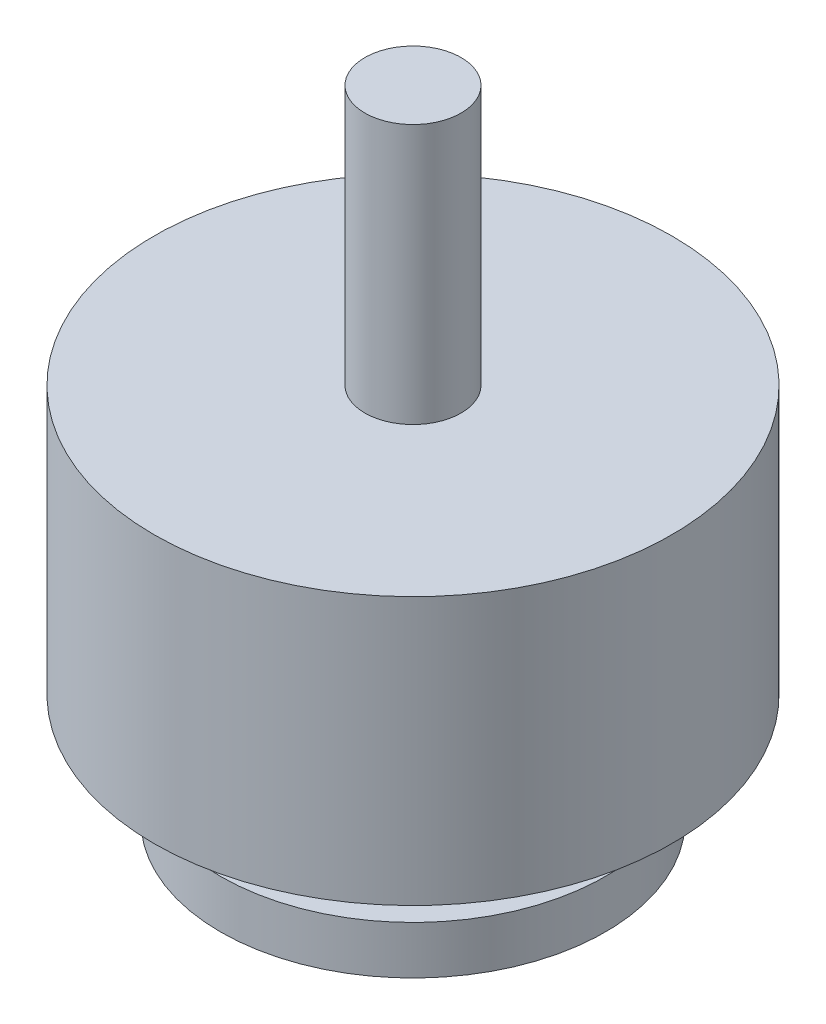
from build123d import *

# Parameters (mm, degrees)
SKETCH1_R           = 13.45
BOSS_EXTRUDE1_DEPTH = 13.9
SKETCH2_R           = 10
SKETCH2_R_2         = 1.5
BOSS_EXTRUDE3_DEPTH = 2.5
BOSS_EXTRUDE4_REACH = 27.578
SKETCH3_R           = 5
SKETCH4_R           = 2.5
BOSS_EXTRUDE5_DEPTH = 13.5


with BuildPart() as part:
    # Sketch1 → Boss-Extrude1 (new body)
    with BuildSketch(Plane(origin=(0, 0, 0), x_dir=(1, 0, 0), z_dir=(0, 1, 0))):
        with Locations(Location((0, 0, 0), (0, 0, 270))):
            Circle(SKETCH1_R)
    extrude(amount=BOSS_EXTRUDE1_DEPTH)

    # Sketch3 → Boss-Extrude4 (add, up to next)
    with BuildSketch(Plane(origin=(0, -3.2, 0), x_dir=(1, 0, 0), z_dir=(0, 1, 0)), mode=Mode.PRIVATE) as boss_extrude4_sk1:
        with Locations(Location((0, 0, 0), (0, 0, 270))):
            Circle(SKETCH3_R)
    boss_extrude4_tool1 = extrude(boss_extrude4_sk1.sketch, amount=BOSS_EXTRUDE4_REACH, mode=Mode.PRIVATE) - part.part


with BuildPart() as body_2:
    # Sketch2 → Boss-Extrude3 (new body)
    with BuildSketch(Plane.XZ.offset(5.7)):
        with Locations(Location((0, 0, 0), (0, 0, 270))):
            Circle(SKETCH2_R)
        with Locations(Location((0, 8, 0), (0, 0, 270))):
            Circle(SKETCH2_R_2, mode=Mode.SUBTRACT)
        with Locations(Location((8, 0, 0), (0, 0, 270))):
            Circle(SKETCH2_R_2, mode=Mode.SUBTRACT)
        with Locations(Location((0, -8, 0), (0, 0, 270))):
            Circle(SKETCH2_R_2, mode=Mode.SUBTRACT)
        with Locations(Location((-8, 0, 0), (0, 0, 270))):
            Circle(SKETCH2_R_2, mode=Mode.SUBTRACT)
    extrude(amount=-BOSS_EXTRUDE3_DEPTH)


with BuildPart() as part_1:
    add(part.part)

    add(body_2.part)  # Boss-Extrude4 merges body 2
    add(boss_extrude4_tool1.solids().sort_by_distance((0, -3.2, 0))[0])

    # Sketch4 → Boss-Extrude5 (add)
    with BuildSketch(Plane(origin=(0, 13.9, 0), x_dir=(1, 0, 0), z_dir=(0, 1, 0))):
        with Locations(Location((0, 0, 0), (0, 0, 270))):
            Circle(SKETCH4_R)
    extrude(amount=BOSS_EXTRUDE5_DEPTH)


solid = part_1.part
